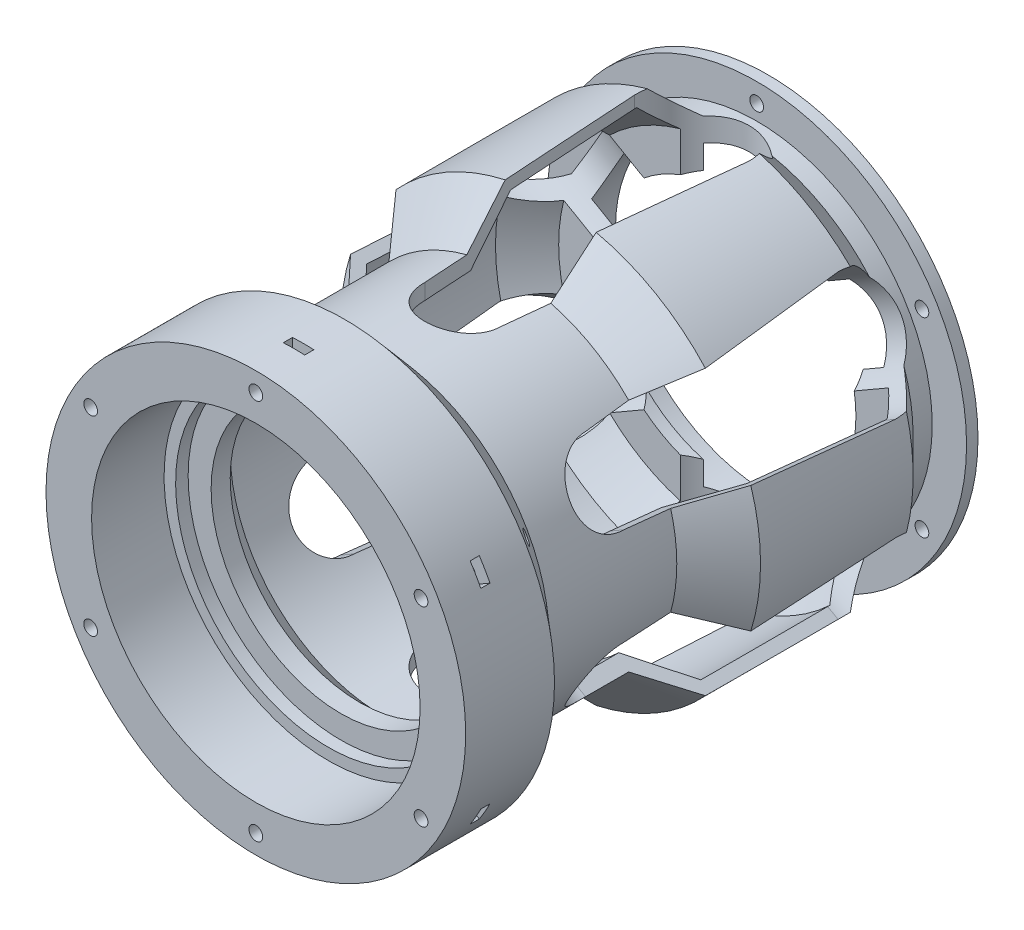
from build123d import *

# Parameters (mm, degrees)
SKETCH3_R           = 1.8
CUT_EXTRUDE1_DEPTH  = 156.180921508
BOSS_EXTRUDE1_START = 5
BOSS_EXTRUDE1_DEPTH = 5
SKETCH5_W           = 5.6
SKETCH5_H           = 11.131010483
CUT_EXTRUDE2_DEPTH  = 2.4
CUT_EXTRUDE3_DEPTH  = 156.180921579
CIRPATTERN1_COUNT   = 3


with BuildPart() as part:
    # Sketch2 → Revolve1 (revolve)
    with BuildSketch(Plane(origin=(0, 0, 0), x_dir=(1, 0, 0), z_dir=(0, 1, 0))):
        Polygon((55, 0), (40.025, 0), (40.025, -8), (34, -8), (34, -11), (43.902605835, -11), (52, -19.465965678), (52, -55.448945518), (40.025, -66.902605835), (40.025, -100.975), (34, -107), (34, -112), (40.025, -112), (40.025, -115.28), (43.05, -115.28), (43.05, -134.28), (55, -134.28), (55, -111), (44.025, -101.499105018), (44.025, -67.975), (55, -57), (55, -17), (46, -8), (46, -3), (55, -3), align=None)
    revolve(axis=Axis((0, 0, 164.117462422), (0, 0, -1)))

    # Sketch3 → Cut-Extrude1 (cut, through all)
    with BuildSketch(Plane.XY.offset(134.28)):
        with Locations(Location((0, 50, 0), (0, 0, 248.096792535))):
            Circle(SKETCH3_R)
        with Locations(Location((43.301270189, 25, 0), (0, 0, 212.603778554))):
            Circle(SKETCH3_R)
        with Locations(Location((43.301270189, -25, 0), (0, 0, 147.396221446))):
            Circle(SKETCH3_R)
        with Locations(Location((0, -50, 0), (0, 0, 111.903207465))):
            Circle(SKETCH3_R)
        with Locations(Location((-43.301270189, -25, 0), (0, 0, 31.919462251))):
            Circle(SKETCH3_R)
        with Locations(Location((-43.301270189, 25, 0), (0, 0, 328.080537749))):
            Circle(SKETCH3_R)
    extrude(amount=-CUT_EXTRUDE1_DEPTH, mode=Mode.SUBTRACT)

    # Sketch4 → Boss-Extrude1 (add)
    with BuildSketch(Plane.XY.offset(115.28).offset(BOSS_EXTRUDE1_START)):
        with BuildLine():
            ThreePointArc((2.45, 42.980228012), (0, 43.05), (-2.45, 42.980228012))
            Line((-2.45, 42.980228012), (-2.45, 39.949945244))
            ThreePointArc((-2.45, 39.949945244), (0, 40.025), (2.45, 39.949945244))
            Line((2.45, 39.949945244), (2.45, 42.980228012))
        make_face()
    extrude(amount=-BOSS_EXTRUDE1_DEPTH)

    # Sketch5 → Cut-Extrude2 (cut)
    with BuildSketch(Plane.XY.offset(124.28)):
        with Locations((0, 52.765505242)):
            Rectangle(SKETCH5_W, SKETCH5_H)
        Polygon((51.916136906, 26.740634111), (49.116136906, 31.590376372), (39.476399059, 26.024871131), (42.276399059, 21.175128869), align=None)
        Polygon((49.116136906, -31.590376372), (51.916136906, -26.740634111), (42.276399059, -21.175128869), (39.476399059, -26.024871131), align=None)
        with Locations((0, -52.765505242)):
            Rectangle(SKETCH5_W, SKETCH5_H)
        Polygon((-51.916136906, -26.740634111), (-49.116136906, -31.590376372), (-39.476399059, -26.024871131), (-42.276399059, -21.175128869), align=None)
        Polygon((-49.116136906, 31.590376372), (-51.916136906, 26.740634111), (-42.276399059, 21.175128869), (-39.476399059, 26.024871131), align=None)
    extrude(amount=-CUT_EXTRUDE2_DEPTH, mode=Mode.SUBTRACT)

    # Sketch6 → Cut-Extrude3 (cut, symmetric)
    with BuildSketch(Plane(origin=(0, 0, 0), x_dir=(1, 0, 0), z_dir=(0, 1, 0))):
        with BuildLine():
            Line((-15, -20), (-10, -80))
            ThreePointArc((-10, -80), (0, -90), (10, -80))
            Line((10, -80), (15, -20))
            ThreePointArc((15, -20), (0, -5), (-15, -20))
        make_face()
    cut_extrude3 = extrude(amount=CUT_EXTRUDE3_DEPTH, both=True, mode=Mode.SUBTRACT)

    # CirPattern1: Cut-Extrude3 ×3 about axis
    cirpattern1_axis = Axis((0, 0, 0), (0, 0, 1))
    for i in range(1, CIRPATTERN1_COUNT):
        add(cut_extrude3.rotate(cirpattern1_axis, i * 360 / CIRPATTERN1_COUNT), mode=Mode.SUBTRACT)


solid = part.part
